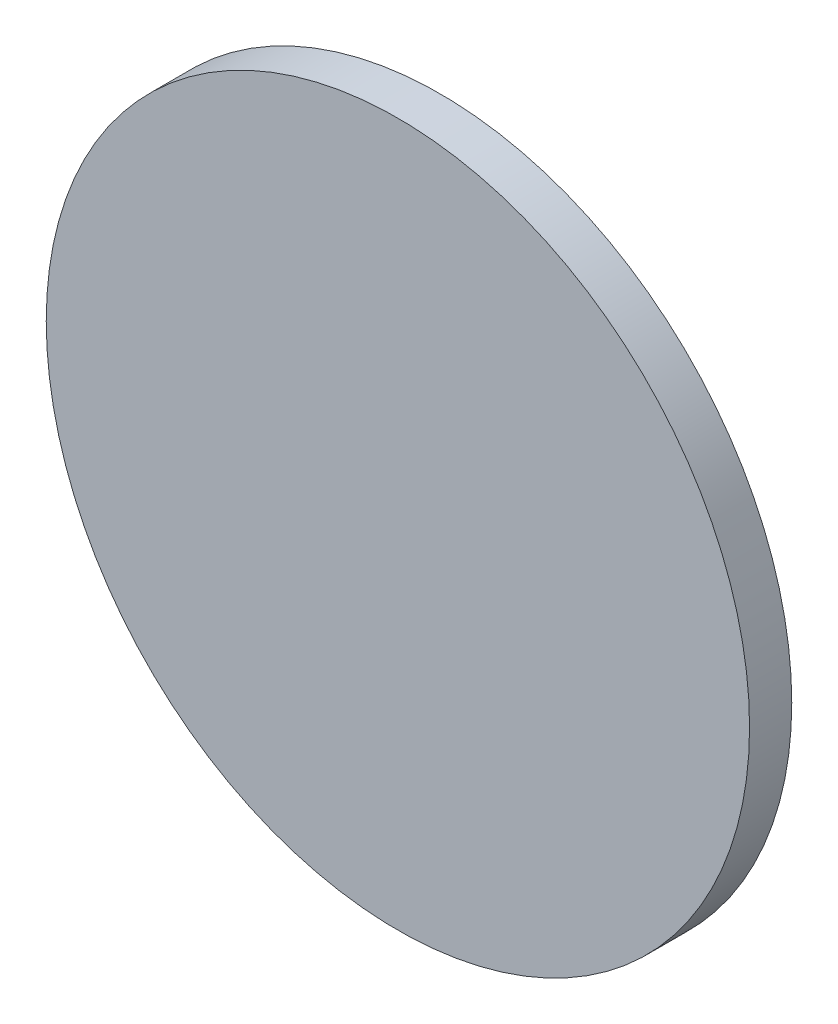
from build123d import *

# Parameters (mm, degrees)
SKICA1_R                = 5
P_IDAT_VYSUNUT_M1_DEPTH = 0.6


with BuildPart() as part:
    # Skica1 → Přidat vysunutím1 (new body)
    with BuildSketch(Plane.XY):
        Circle(SKICA1_R)
    extrude(amount=P_IDAT_VYSUNUT_M1_DEPTH)


solid = part.part
